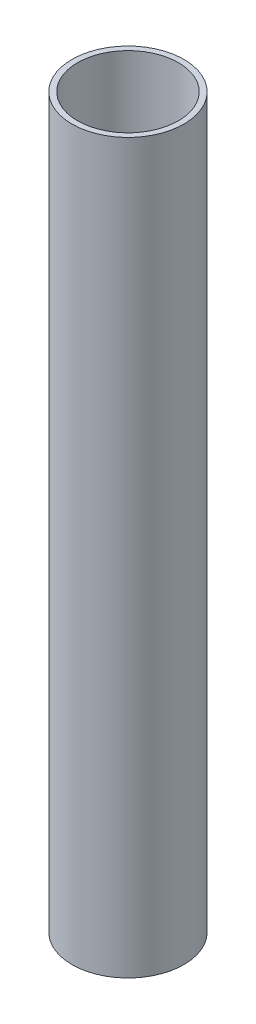
from build123d import *

# Parameters (mm, degrees)
SKETCH1_R           = 10
SKETCH1_R_2         = 9
BOSS_EXTRUDE1_DEPTH = 130


with BuildPart() as part:
    # Sketch1 → Boss-Extrude1 (new body)
    with BuildSketch(Plane(origin=(0, 0, 0), x_dir=(1, 0, 0), z_dir=(0, 1, 0))):
        with Locations(Location((0, 0, 0), (0, 0, 270))):
            Circle(SKETCH1_R)
        with Locations(Location((0, 0, 0), (0, 0, 270))):
            Circle(SKETCH1_R_2, mode=Mode.SUBTRACT)
    extrude(amount=BOSS_EXTRUDE1_DEPTH)


solid = part.part
